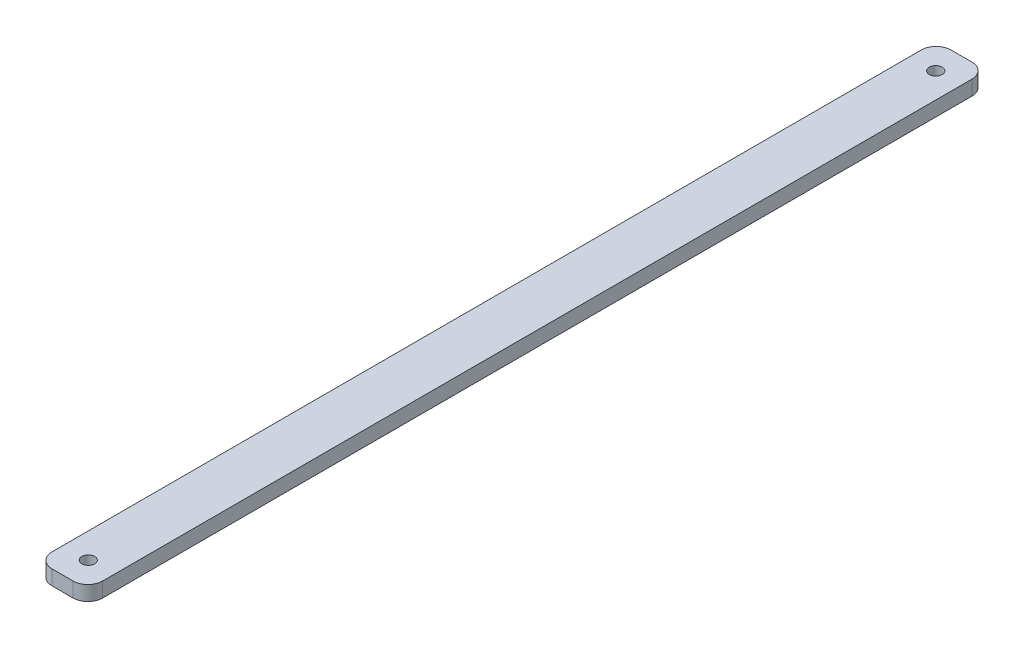
from build123d import *

# Parameters (mm, degrees)
SKETCH1_W           = 10
SKETCH1_H           = 177.8
SKETCH1_R           = 1.27
BOSS_EXTRUDE1_DEPTH = 2.921
FILLET1_R           = 2.921


with BuildPart() as part:
    # Sketch1 → Boss-Extrude1 (new body)
    with BuildSketch(Plane(origin=(0, 0, 0), x_dir=(1, 0, 0), z_dir=(0, 1, 0))):
        Rectangle(SKETCH1_W, SKETCH1_H)
        with Locations(Location((0, 83.82, 0), (0, 0, 270))):
            Circle(SKETCH1_R, mode=Mode.SUBTRACT)
        with Locations(Location((0, -83.82, 0), (0, 0, 270))):
            Circle(SKETCH1_R, mode=Mode.SUBTRACT)
    extrude(amount=BOSS_EXTRUDE1_DEPTH)

    # Fillet1
    fillet1_edges = [part.edges().sort_by_distance(p)[0] for p in [
        (5, 1.4605, 88.9),
        (-5, 1.4605, 88.9),
        (-5, 1.4605, -88.9),
        (5, 1.4605, -88.9),
    ]]
    fillet(fillet1_edges, radius=FILLET1_R)


solid = part.part
